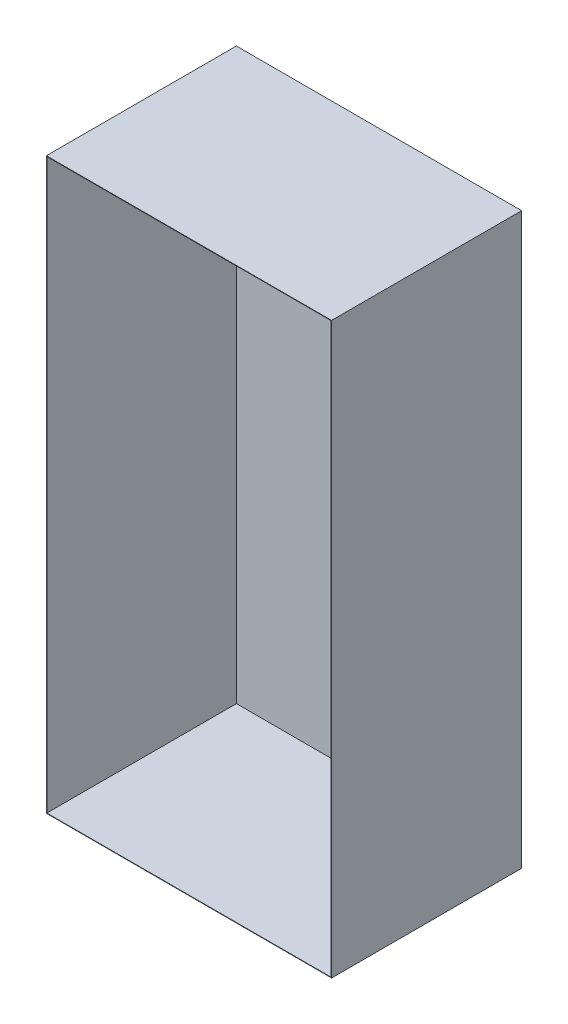
from build123d import *

# Parameters (mm, degrees)
FRONT_W             = 152.908
FRONT_H             = 305.308
BOSS_EXTRUDE1_DEPTH = 101.854
SKETCH3_W           = 152.4
SKETCH3_H           = 304.8
CUT_EXTRUDE1_DEPTH  = 101.6


with BuildPart() as part:
    # Front → Boss-Extrude1 (new body)
    with BuildSketch(Plane.XY):
        Rectangle(FRONT_W, FRONT_H)
    extrude(amount=BOSS_EXTRUDE1_DEPTH)

    # Sketch3 → Cut-Extrude1 (cut)
    with BuildSketch(Plane.XY.offset(101.854)):
        Rectangle(SKETCH3_W, SKETCH3_H)
    extrude(amount=-CUT_EXTRUDE1_DEPTH, mode=Mode.SUBTRACT)


solid = part.part
